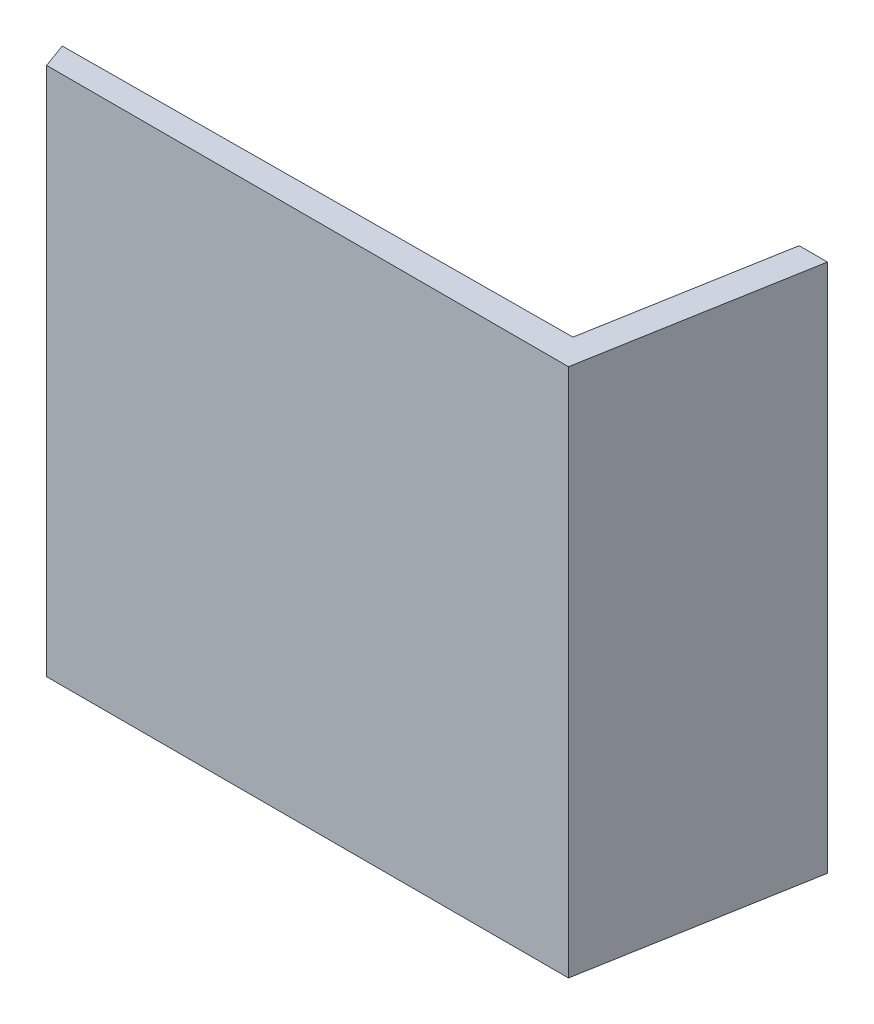
from build123d import *

# Parameters (mm, degrees)
BOSS_EXTRUDE1_DEPTH = 95


with BuildPart() as part:
    # Sketch1 → Boss-Extrude1 (new body)
    with BuildSketch(Plane(origin=(0, 0, 0), x_dir=(-1, 0, 0), z_dir=(0, 1, 0))):
        Polygon((28.132122167, -13), (-65.526137841, -13), (-72.491053579, -52.5), (-67.41392052, -52.5), (-61.330639685, -18), (29.739091192, -17.415111108), align=None)
    extrude(amount=BOSS_EXTRUDE1_DEPTH)


solid = part.part
